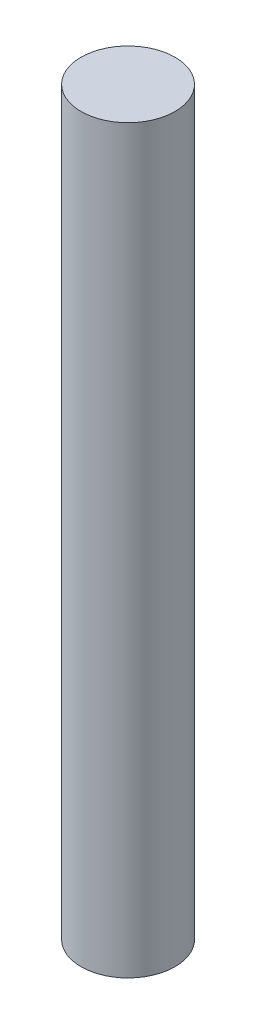
from build123d import *

# Parameters (mm, degrees)
SKETCH1_R           = 3.175
BOSS_EXTRUDE1_DEPTH = 50.025


with BuildPart() as part:
    # Sketch1 → Boss-Extrude1 (new body)
    with BuildSketch(Plane(origin=(0, 0, 0), x_dir=(1, 0, 0), z_dir=(0, 1, 0))):
        with Locations(Location((0, 0, 0), (0, 0, 90))):
            Circle(SKETCH1_R)
    extrude(amount=BOSS_EXTRUDE1_DEPTH)


solid = part.part
